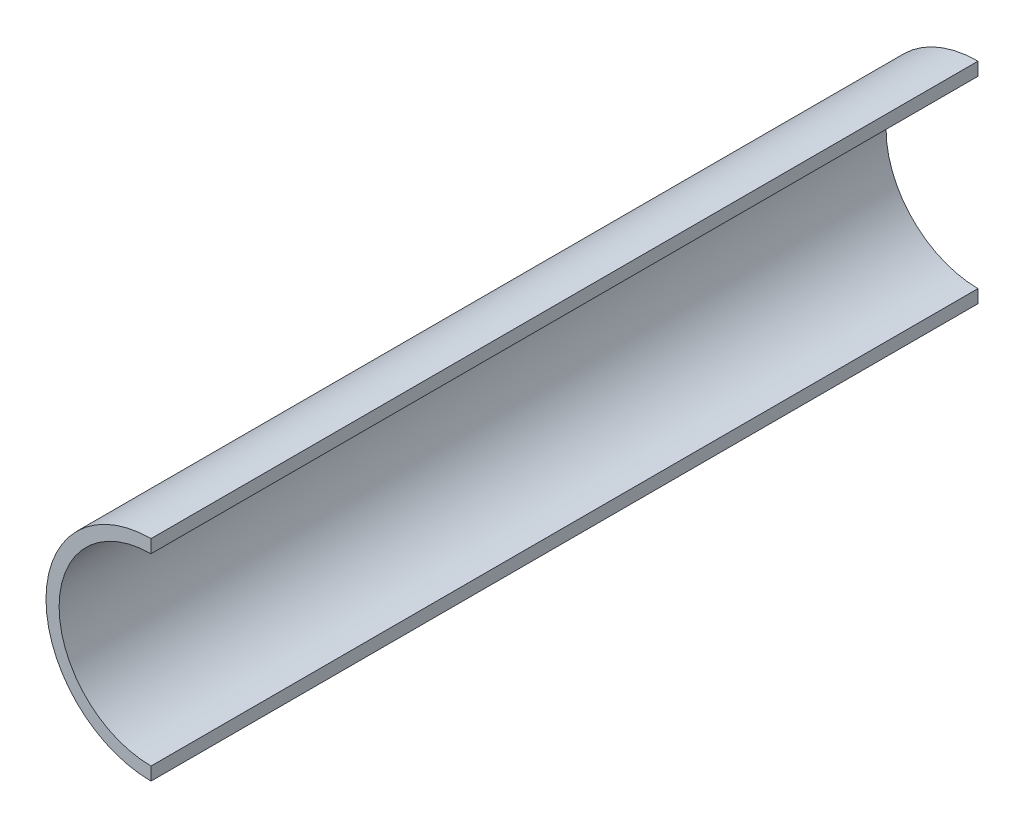
from build123d import *

# Parameters (mm, degrees)
RESSALTO_EXTRUS_O1_DEPTH = 200


with BuildPart() as part:
    # Esboço1 → Ressalto-extrusão1 (new body)
    with BuildSketch(Plane.XY):
        with BuildLine():
            Line((0, -25.4), (0, -22.23))
            ThreePointArc((0, -22.23), (-22.23, 0), (0, 22.23))
            Line((0, 22.23), (0, 25.4))
            ThreePointArc((0, 25.4), (-25.4, 0), (0, -25.4))
        make_face()
    extrude(amount=RESSALTO_EXTRUS_O1_DEPTH)


solid = part.part
